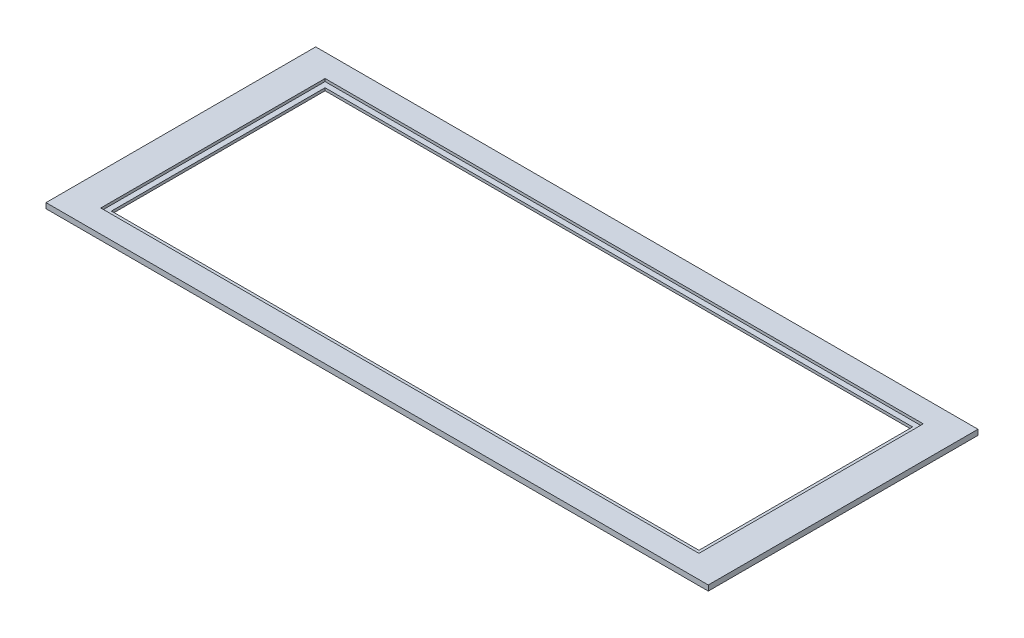
from build123d import *

# Parameters (mm, degrees)
SKETCH1_W           = 1240
SKETCH1_H           = 505
BOSS_EXTRUDE1_DEPTH = 10
SKETCH2_W           = 1100
SKETCH2_H           = 400
CUT_EXTRUDE1_DEPTH  = 670.519417194
SKETCH3_W           = 1120
SKETCH3_H           = 420
CUT_EXTRUDE2_DEPTH  = 5


with BuildPart() as part:
    # Sketch1 → Boss-Extrude1 (new body)
    with BuildSketch(Plane(origin=(0, 0, 0), x_dir=(1, 0, 0), z_dir=(0, 1, 0))):
        Rectangle(SKETCH1_W, SKETCH1_H)
    extrude(amount=BOSS_EXTRUDE1_DEPTH)

    # Sketch2 → Cut-Extrude1 (cut, through all)
    with BuildSketch(Plane(origin=(0, 10, 0), x_dir=(1, 0, 0), z_dir=(0, 1, 0))):
        Rectangle(SKETCH2_W, SKETCH2_H)
    extrude(amount=-CUT_EXTRUDE1_DEPTH, mode=Mode.SUBTRACT)

    # Sketch3 → Cut-Extrude2 (cut)
    with BuildSketch(Plane(origin=(0, 10, 0), x_dir=(1, 0, 0), z_dir=(0, 1, 0))):
        Rectangle(SKETCH3_W, SKETCH3_H)
    extrude(amount=-CUT_EXTRUDE2_DEPTH, mode=Mode.SUBTRACT)


solid = part.part
